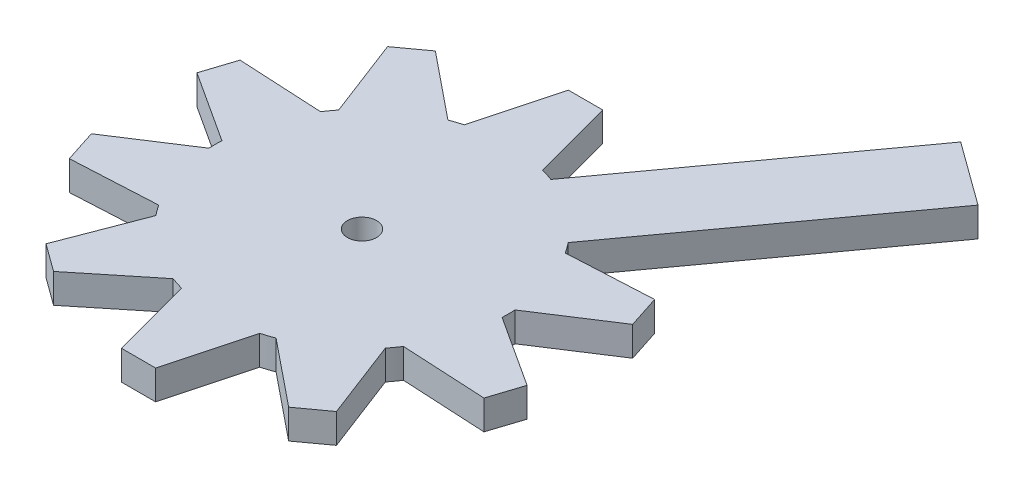
from build123d import *

# Parameters (mm, degrees)
SKETCH1_R           = 15
BOSS_EXTRUDE1_DEPTH = 3
BOSS_EXTRUDE4_DEPTH = 3
BOSS_EXTRUDE5_DEPTH = 3
SKETCH4_R           = 1.5
CUT_EXTRUDE1_DEPTH  = 3


with BuildPart() as part:
    # Sketch1 → Boss-Extrude1 (new body)
    with BuildSketch(Plane(origin=(0, 0, 0), x_dir=(1, 0, 0), z_dir=(0, 1, 0))):
        with Locations(Location((0, 0, 0), (0, 0, 270))):
            Circle(SKETCH1_R)
    extrude(amount=BOSS_EXTRUDE1_DEPTH)

    # Sketch2 → Boss-Extrude4 (add)
    with BuildSketch(Plane(origin=(0, 3, 0), x_dir=(1, 0, 0), z_dir=(0, 1, 0))):
        Polygon((1.75, -22.853946612), (-1.75, -22.853946612), (-4, -14.456832295), (4, -14.456832295), align=None)
        Polygon((-14.848992515, -17.460607006), (-11.733580795, -9.344682002), (-5.26144484, -14.04696402), (-12.017433035, -19.517855389), align=None)
        Polygon((-22.276174588, -5.397908988), (-14.985332536, -0.663180799), (-12.513196581, -8.271632929), (-21.194615108, -8.726606795), align=None)
        Polygon((-21.194615108, 8.726606795), (-12.513196581, 8.271632929), (-14.985332536, 0.663180799), (-22.276174588, 5.397908988), align=None)
        Polygon((-12.017433035, 19.517855389), (-5.26144484, 14.04696402), (-11.733580795, 9.344682002), (-14.848992515, 17.460607006), align=None)
        Polygon((1.75, 22.853946612), (4, 14.456832295), (-4, 14.456832295), (-1.75, 22.853946612), align=None)
        Polygon((14.848992515, 17.460607006), (11.733580795, 9.344682002), (5.26144484, 14.04696402), (12.017433035, 19.517855389), align=None)
        Polygon((22.276174588, 5.397908988), (14.985332536, 0.663180799), (12.513196581, 8.271632929), (21.194615108, 8.726606795), align=None)
        Polygon((21.194615108, -8.726606795), (12.513196581, -8.271632929), (14.985332536, -0.663180799), (22.276174588, -5.397908988), align=None)
        Polygon((12.017433035, -19.517855389), (5.26144484, -14.04696402), (11.733580795, -9.344682002), (14.848992515, -17.460607006), align=None)
    extrude(amount=-BOSS_EXTRUDE4_DEPTH)

    # Sketch3 → Boss-Extrude5 (add)
    with BuildSketch(Plane(origin=(0, 3, 0), x_dir=(1, 0, 0), z_dir=(0, 1, 0))):
        Polygon((0, 0), (5.26144484, 14.04696402), (22.895002409, 38.317473852), (29.367138364, 33.615191833), (11.733580795, 9.344682002), align=None)
    extrude(amount=-BOSS_EXTRUDE5_DEPTH)

    # Sketch4 → Cut-Extrude1 (cut)
    with BuildSketch(Plane(origin=(0, 3, 0), x_dir=(1, 0, 0), z_dir=(0, 1, 0))):
        with Locations(Location((0, 0, 0), (0, 0, 270))):
            Circle(SKETCH4_R)
    extrude(amount=-CUT_EXTRUDE1_DEPTH, mode=Mode.SUBTRACT)


solid = part.part
